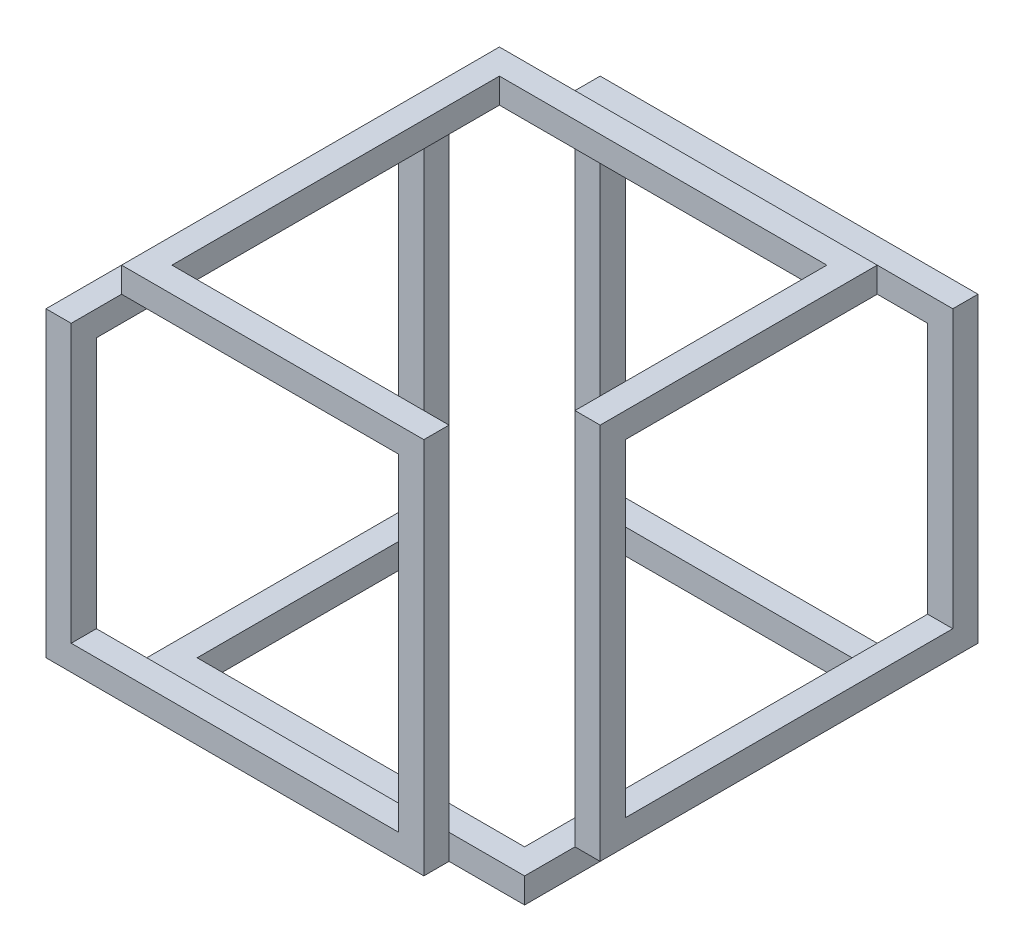
from build123d import *

# Parameters (mm, degrees)
ESTRUSIONE_ESTRUSIONE1_DEPTH  = 10
SCHIZZO10_W                   = 10
SCHIZZO10_H                   = 10
ESTRUSIONE_ESTRUSIONE4_DEPTH  = 140
SCHIZZO11_W                   = 10
SCHIZZO11_H                   = 10
ESTRUSIONE_ESTRUSIONE5_DEPTH  = 140
SCHIZZO12_W                   = 10
SCHIZZO12_H                   = 10
ESTRUSIONE_ESTRUSIONE6_DEPTH  = 100
SCHIZZO13_W                   = 10
SCHIZZO13_H                   = 10
ESTRUSIONE_ESTRUSIONE7_DEPTH  = 140
SCHIZZO16_W                   = 10
SCHIZZO16_H                   = 10
ESTRUSIONE_ESTRUSIONE8_DEPTH  = 140
SCHIZZO17_W                   = 10
SCHIZZO17_H                   = 10
ESTRUSIONE_ESTRUSIONE9_DEPTH  = 140
SCHIZZO19_W                   = 10
SCHIZZO19_H                   = 10
ESTRUSIONE_ESTRUSIONE10_DEPTH = 100
SCHIZZO20_W                   = 10
SCHIZZO20_H                   = 10
ESTRUSIONE_ESTRUSIONE11_DEPTH = 140
SCHIZZO21_W                   = 10
SCHIZZO21_H                   = 10
ESTRUSIONE_ESTRUSIONE12_DEPTH = 140
SCHIZZO22_W                   = 10
SCHIZZO22_H                   = 10
ESTRUSIONE_ESTRUSIONE13_DEPTH = 110
SCHIZZO23_W                   = 10
SCHIZZO23_H                   = 10
ESTRUSIONE_ESTRUSIONE14_DEPTH = 140
SCHIZZO24_W                   = 10
SCHIZZO24_H                   = 10
ESTRUSIONE_ESTRUSIONE15_DEPTH = 110
SCHIZZO25_W                   = 10
SCHIZZO25_H                   = 10
ESTRUSIONE_ESTRUSIONE16_DEPTH = 140
SCHIZZO26_W                   = 10
SCHIZZO26_H                   = 10
ESTRUSIONE_ESTRUSIONE17_DEPTH = 140


with BuildPart() as part:
    # Schizzo1 → Estrusione-Estrusione1 (new body)
    with BuildSketch(Plane.XY):
        Polygon((45, -75), (-75, -75), (-75, 75), (75, 75), (75, -45), (65, -45), (65, 65), (-65, 65), (-65, -65), (45, -65), align=None)
    extrude(amount=ESTRUSIONE_ESTRUSIONE1_DEPTH)

    # Schizzo10 → Estrusione-Estrusione4 (add)
    with BuildSketch(Plane.XY.offset(10)):
        with Locations((40, -70)):
            Rectangle(SCHIZZO10_W, SCHIZZO10_H)
    extrude(amount=ESTRUSIONE_ESTRUSIONE4_DEPTH)

    # Schizzo11 → Estrusione-Estrusione5 (add)
    with BuildSketch(Plane.ZY.offset(-35)):
        with Locations((145, -70)):
            Rectangle(SCHIZZO11_W, SCHIZZO11_H)
    extrude(amount=ESTRUSIONE_ESTRUSIONE5_DEPTH)

    # Schizzo12 → Estrusione-Estrusione6 (add)
    with BuildSketch(Plane(origin=(0, 0, 140), x_dir=(-1, 0, 0), z_dir=(0, 0, -1))):
        with Locations((100, -70)):
            Rectangle(SCHIZZO12_W, SCHIZZO12_H)
    extrude(amount=ESTRUSIONE_ESTRUSIONE6_DEPTH)

    # Schizzo13 → Estrusione-Estrusione7 (add)
    with BuildSketch(Plane(origin=(0, -65, 0), x_dir=(1, 0, 0), z_dir=(0, 1, 0))):
        with Locations((-100, -45)):
            Rectangle(SCHIZZO13_W, SCHIZZO13_H)
    extrude(amount=ESTRUSIONE_ESTRUSIONE7_DEPTH)

    # Schizzo16 → Estrusione-Estrusione8 (add)
    with BuildSketch(Plane.XY.offset(10)):
        with Locations((70, -40)):
            Rectangle(SCHIZZO16_W, SCHIZZO16_H)
    extrude(amount=ESTRUSIONE_ESTRUSIONE8_DEPTH)

    # Schizzo17 → Estrusione-Estrusione9 (add)
    with BuildSketch(Plane(origin=(0, -35, 0), x_dir=(1, 0, 0), z_dir=(0, 1, 0))):
        with Locations((70, -145)):
            Rectangle(SCHIZZO17_W, SCHIZZO17_H)
    extrude(amount=ESTRUSIONE_ESTRUSIONE9_DEPTH)

    # Schizzo19 → Estrusione-Estrusione10 (add)
    with BuildSketch(Plane(origin=(0, 0, 140), x_dir=(-1, 0, 0), z_dir=(0, 0, -1))):
        with Locations((-70, 100)):
            Rectangle(SCHIZZO19_W, SCHIZZO19_H)
    extrude(amount=ESTRUSIONE_ESTRUSIONE10_DEPTH)

    # Schizzo20 → Estrusione-Estrusione11 (add)
    with BuildSketch(Plane.ZY.offset(-65)):
        with Locations((45, 100)):
            Rectangle(SCHIZZO20_W, SCHIZZO20_H)
    extrude(amount=ESTRUSIONE_ESTRUSIONE11_DEPTH)

    # Schizzo21 → Estrusione-Estrusione12 (add)
    with BuildSketch(Plane.XY.offset(50)):
        with Locations((-70, 100)):
            Rectangle(SCHIZZO21_W, SCHIZZO21_H)
    extrude(amount=ESTRUSIONE_ESTRUSIONE12_DEPTH)

    # Schizzo22 → Estrusione-Estrusione13 (add)
    with BuildSketch(Plane(origin=(-65, 0, 0), x_dir=(0, 0, -1), z_dir=(1, 0, 0))):
        with Locations((-185, 100)):
            Rectangle(SCHIZZO22_W, SCHIZZO22_H)
    extrude(amount=ESTRUSIONE_ESTRUSIONE13_DEPTH)

    # Schizzo23 → Estrusione-Estrusione14 (add)
    with BuildSketch(Plane.XY.offset(50)):
        with Locations((-100, 70)):
            Rectangle(SCHIZZO23_W, SCHIZZO23_H)
    extrude(amount=ESTRUSIONE_ESTRUSIONE14_DEPTH)

    # Schizzo24 → Estrusione-Estrusione15 (add)
    with BuildSketch(Plane.XZ.offset(-65)):
        with Locations((-100, 185)):
            Rectangle(SCHIZZO24_W, SCHIZZO24_H)
    extrude(amount=ESTRUSIONE_ESTRUSIONE15_DEPTH)

    # Schizzo25 → Estrusione-Estrusione16 (add)
    with BuildSketch(Plane(origin=(-95, 0, 0), x_dir=(0, 0, -1), z_dir=(1, 0, 0))):
        with Locations((-185, -40)):
            Rectangle(SCHIZZO25_W, SCHIZZO25_H)
    extrude(amount=ESTRUSIONE_ESTRUSIONE16_DEPTH)

    # Schizzo26 → Estrusione-Estrusione17 (add)
    with BuildSketch(Plane.XZ.offset(-95)):
        with Locations((40, 185)):
            Rectangle(SCHIZZO26_W, SCHIZZO26_H)
    extrude(amount=ESTRUSIONE_ESTRUSIONE17_DEPTH)


solid = part.part
